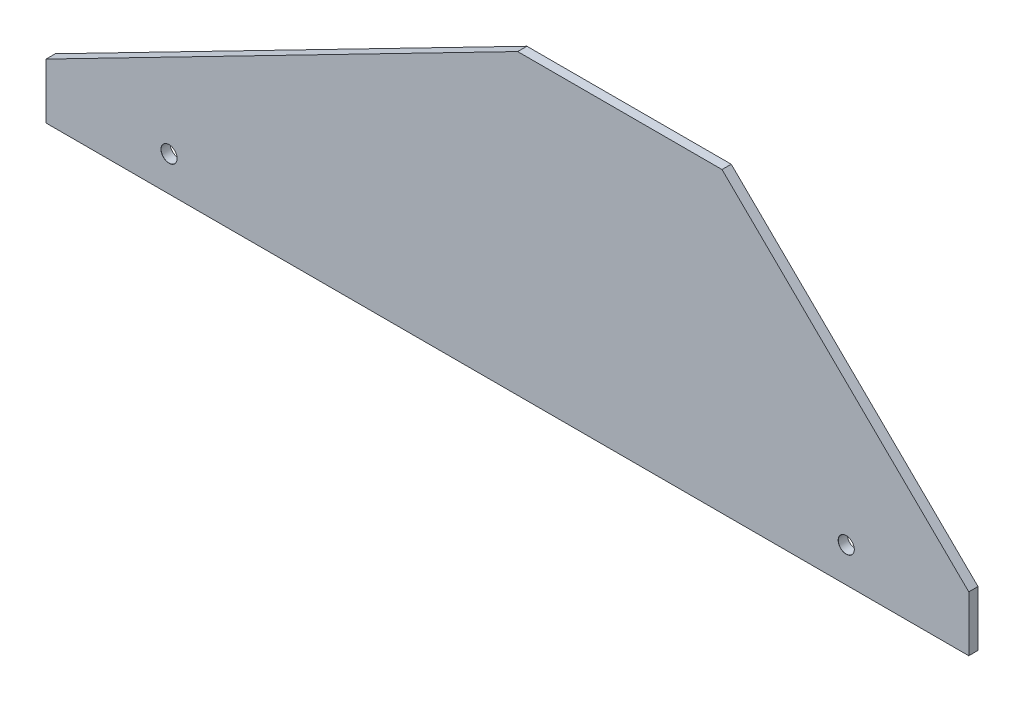
from build123d import *

# Parameters (mm, degrees)
Y_KSEKLIK_EKSTR_ZYON1_DEPTH                    = 3
M5_HELISARMAL_I_IN_Z_VANA_MATKAB_3_D           = 5.2
M5_HELISARMAL_I_IN_Z_VANA_MATKAB_3_DEPTH       = 18
M5_HELISARMAL_I_IN_Z_VANA_MATKAB_3_CSINK_D     = 5.25
M5_HELISARMAL_I_IN_Z_VANA_MATKAB_3_CSINK_ANGLE = 90
M5_HELISARMAL_I_IN_Z_VANA_MATKAB_3_TIP         = 1.562237609
M5_HELISARMAL_I_IN_Z_VANA_MATKAB_2_D           = 5.2
M5_HELISARMAL_I_IN_Z_VANA_MATKAB_2_DEPTH       = 18
M5_HELISARMAL_I_IN_Z_VANA_MATKAB_2_CSINK_D     = 5.25
M5_HELISARMAL_I_IN_Z_VANA_MATKAB_2_CSINK_ANGLE = 90
M5_HELISARMAL_I_IN_Z_VANA_MATKAB_2_TIP         = 1.562237609


with BuildPart() as part:
    # Çizim1 → Yükseklik-Ekstrüzyon1 (new body)
    with BuildSketch(Plane.XY):
        Polygon((150, 18), (150, 0), (-150, 0), (-150, 18), (3.342667003, 96.78849493), (69.768417769, 96.78849493), align=None)
    extrude(amount=Y_KSEKLIK_EKSTR_ZYON1_DEPTH)

    # M5 Helisarmal için Zıvana matkabı3
    with Locations(Plane.XY.offset(3)):
        with Locations((-110, 11.3), (110.16, 11.3)):
            CounterSinkHole(M5_HELISARMAL_I_IN_Z_VANA_MATKAB_3_D / 2, M5_HELISARMAL_I_IN_Z_VANA_MATKAB_3_CSINK_D / 2, depth=M5_HELISARMAL_I_IN_Z_VANA_MATKAB_3_DEPTH, counter_sink_angle=M5_HELISARMAL_I_IN_Z_VANA_MATKAB_3_CSINK_ANGLE)
            with Locations((0, 0, -(M5_HELISARMAL_I_IN_Z_VANA_MATKAB_3_DEPTH + M5_HELISARMAL_I_IN_Z_VANA_MATKAB_3_TIP / 2))):  # 118° drill point
                Cone(0, M5_HELISARMAL_I_IN_Z_VANA_MATKAB_3_D / 2, M5_HELISARMAL_I_IN_Z_VANA_MATKAB_3_TIP, mode=Mode.SUBTRACT)

    # M5 Helisarmal için Zıvana matkabı2
    with Locations(Plane.XY.offset(3)):
        with Locations((-110, 11.3), (110.16, 11.3)):
            CounterSinkHole(M5_HELISARMAL_I_IN_Z_VANA_MATKAB_2_D / 2, M5_HELISARMAL_I_IN_Z_VANA_MATKAB_2_CSINK_D / 2, depth=M5_HELISARMAL_I_IN_Z_VANA_MATKAB_2_DEPTH, counter_sink_angle=M5_HELISARMAL_I_IN_Z_VANA_MATKAB_2_CSINK_ANGLE)
            with Locations((0, 0, -(M5_HELISARMAL_I_IN_Z_VANA_MATKAB_2_DEPTH + M5_HELISARMAL_I_IN_Z_VANA_MATKAB_2_TIP / 2))):  # 118° drill point
                Cone(0, M5_HELISARMAL_I_IN_Z_VANA_MATKAB_2_D / 2, M5_HELISARMAL_I_IN_Z_VANA_MATKAB_2_TIP, mode=Mode.SUBTRACT)


solid = part.part
